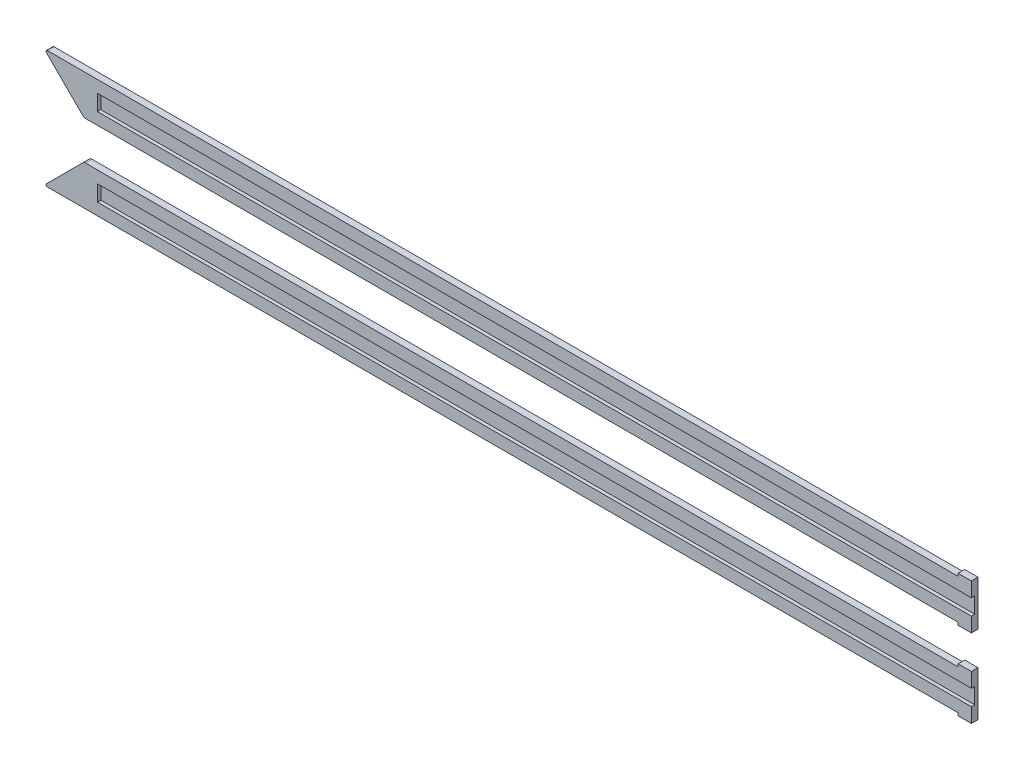
from build123d import *

# Parameters (mm, degrees)
SKETCH_2_W          = 10
SKETCH_2_H          = 2
EXTRUDE_1_DEPTH     = 5
SKETCH_3_W          = 660
SKETCH_3_H          = 12
CUT_EXTRUDE_1_DEPTH = 2.5


with BuildPart() as part:
    # 草图2 → 凸台-拉伸1 (new body)
    with BuildSketch(Plane.XY):
        with BuildLine():
            ThreePointArc((-80.482238339, 44.580601224), (-81.406117872, 43.963284656), (-81.18934512, 42.873494443))
            Line((-81.18934512, 42.873494443), (-53.775131558, 15.45928088))
            ThreePointArc((-53.775131558, 15.45928088), (-52.801861511, 14.808962626), (-51.653811214, 14.580601224))
            Line((-51.653811214, 14.580601224), (606.848948473, 14.580601224))
            Line((606.848948473, 14.580601224), (616.848948473, 14.580601224))
            Line((616.848948473, 14.580601224), (616.848948473, 44.580601224))
            Line((616.848948473, 44.580601224), (606.848948473, 44.580601224))
            Line((606.848948473, 44.580601224), (-80.482238339, 44.580601224))
        make_face()
        with Locations((611.848948473, 45.580601224)):
            Rectangle(SKETCH_2_W, SKETCH_2_H)
        with Locations((611.848948473, 13.580601224)):
            Rectangle(SKETCH_2_W, SKETCH_2_H)
    extrude(amount=EXTRUDE_1_DEPTH)

    # 草图3 → 切除-拉伸1 (cut)
    with BuildSketch(Plane.XY.offset(5)):
        with Locations((287.380589783, 29.580601224)):
            Rectangle(SKETCH_3_W, SKETCH_3_H)
    extrude(amount=-CUT_EXTRUDE_1_DEPTH, mode=Mode.SUBTRACT)


with BuildPart() as body_2:
    # 镜向9: mirrored copy
    add(part.part.mirror(Plane.ZX))


solid = Compound([part.part, body_2.part])
